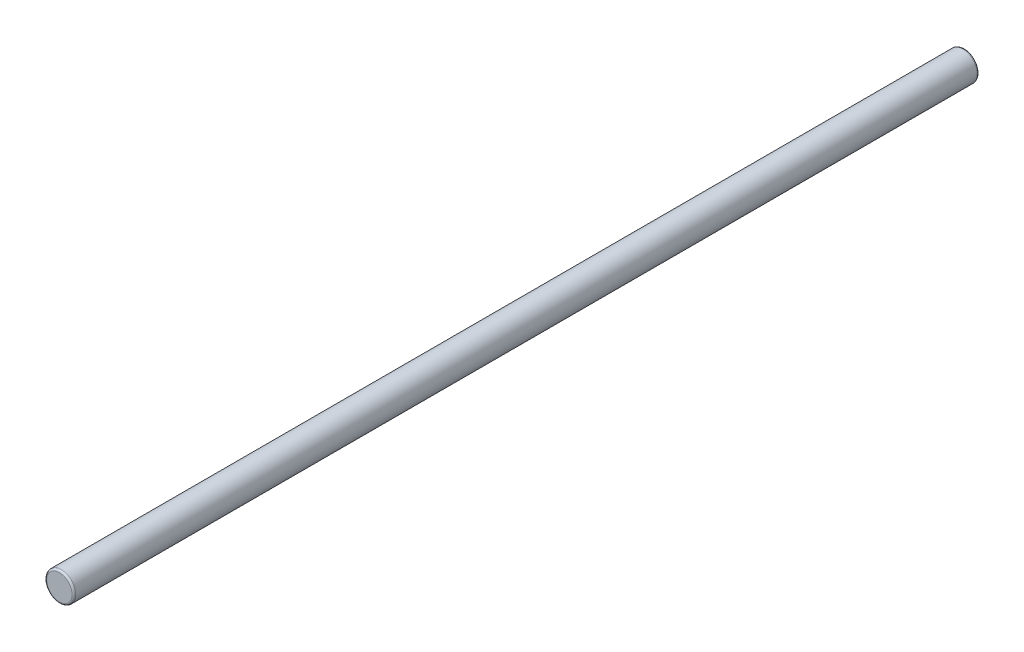
from build123d import *

# Parameters (mm, degrees)
ESQUISSE1_R        = 4
BOSS_EXTRU_1_DEPTH = 250
CONG_1_R           = 0.5


with BuildPart() as part:
    # Esquisse1 → Boss.-Extru.1 (new body)
    with BuildSketch(Plane.XY):
        Circle(ESQUISSE1_R)
    extrude(amount=BOSS_EXTRU_1_DEPTH)

    # Congé1
    cong_1_edges = [part.edges().sort_by_distance(p)[0] for p in [
        (-4, 0, 0),
        (-4, 0, 250),
    ]]
    fillet(cong_1_edges, radius=CONG_1_R)


solid = part.part
